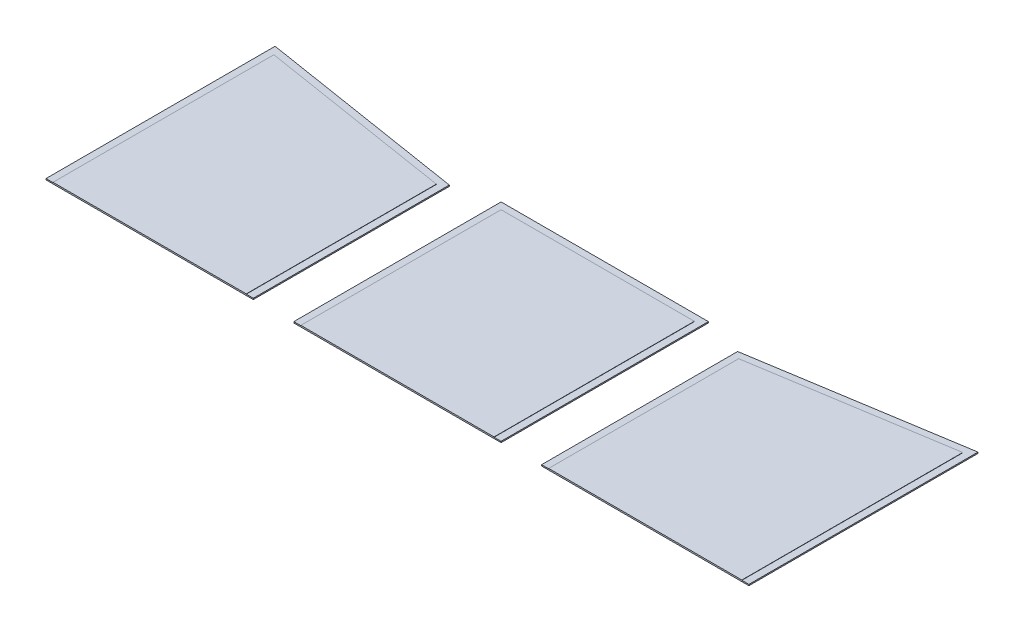
from build123d import *

# Parameters (mm, degrees)
SKETCH1_W             = 153.5
SKETCH1_H             = 153.5
BOSS_EXTRUDE1_DEPTH   = 0.9
BOSS_EXTRUDE1_2_DEPTH = 0.9
BOSS_EXTRUDE1_3_DEPTH = 0.9
SKETCH2_W             = 143.1
SKETCH2_H             = 148.3
BOSS_EXTRUDE2_DEPTH   = 0.2


with BuildPart() as part:
    # Sketch1 → Boss-Extrude1 (new body)
    with BuildSketch(Plane(origin=(0, 0, 0), x_dir=(1, 0, 0), z_dir=(0, 1, 0))):
        Rectangle(SKETCH1_W, SKETCH1_H)
    extrude(amount=BOSS_EXTRUDE1_DEPTH)



with BuildPart() as body_2:
    # Sketch1 → Boss-Extrude1 2 (new body)
    with BuildSketch(Plane(origin=(0, 0, 0), x_dir=(1, 0, 0), z_dir=(0, 1, 0))):
        Polygon((-260.256246951, 92.895183815), (-260.25, -76.75), (-106.75, -76.75), (-106.75, 68.39950611), align=None)
    extrude(amount=BOSS_EXTRUDE1_2_DEPTH)


with BuildPart() as body_3:
    # Sketch1 → Boss-Extrude1 3 (new body)
    with BuildSketch(Plane(origin=(0, 0, 0), x_dir=(1, 0, 0), z_dir=(0, 1, 0))):
        Polygon((260.256246951, 92.895183815), (106.75, 68.39950611), (106.75, -76.75), (260.25, -76.75), align=None)
    extrude(amount=BOSS_EXTRUDE1_3_DEPTH)


with BuildPart() as part_1:
    add(part.part)

    add(body_2.part)  # Boss-Extrude2 merges body 2

    add(body_3.part)  # Boss-Extrude2 merges body 3
    # Sketch2 → Boss-Extrude2 (add)
    with BuildSketch(Plane(origin=(0, 0.9, 0), x_dir=(1, 0, 0), z_dir=(0, 1, 0))):
        with Locations((0, -2.6)):
            Rectangle(SKETCH2_W, SKETCH2_H)
        Polygon((-111.95, -76.75), (-111.95, 63.963503104), (-255.056022485, 86.799570522), (-255.049999996, -76.75), align=None)
        Polygon((111.95, -76.75), (111.95, 63.963503104), (255.056022485, 86.799570522), (255.049999996, -76.75), align=None)
    extrude(amount=BOSS_EXTRUDE2_DEPTH)


solid = part_1.part
